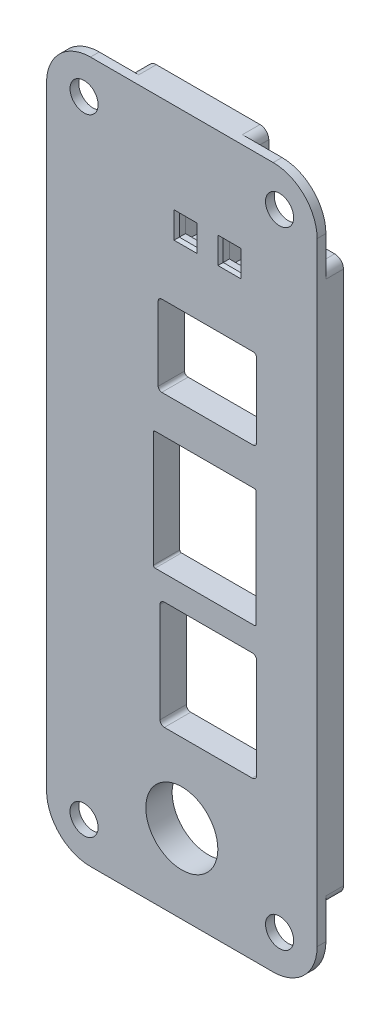
from build123d import *

# Parameters (mm, degrees)
SKETCH_1_W          = 2
SKETCH_1_H          = 2.4
EXTRUDE_1_DEPTH     = 3
SKETCH_2_W          = 11
SKETCH_2_H          = 38
CUT_EXTRUDE_1_DEPTH = 1
CUT_EXTRUDE_START   = -2
CUT_EXTRUDE_2_DEPTH = 2
SKETCH_4_R          = 1.6
CUT_EXTRUDE_3_DEPTH = 62.990079852
SKETCH_6_W          = 2.2
SKETCH_6_H          = 4
CUT_EXTRUDE_4_DEPTH = 2
SKETCH_7_R          = 4.1
CUT_EXTRUDE_5_DEPTH = 63.030395775
FILLET_1_R          = 1
CHAMFER_1_SIZE      = 0.3


with BuildPart() as part:
    # 草图1 → 凸台-拉伸1 (new body)
    with BuildSketch(Plane.XY):
        with BuildLine():
            Line((47.4, -34.9), (47.4, 34.9))
            ThreePointArc((47.4, 34.9), (45.935533906, 38.435533906), (42.4, 39.9))
            Line((42.4, 39.9), (21.6, 39.9))
            ThreePointArc((21.6, 39.9), (18.064466094, 38.435533906), (16.6, 34.9))
            Line((16.6, 34.9), (16.6, -34.9))
            ThreePointArc((16.6, -34.9), (18.064466094, -38.435533906), (21.6, -39.9))
            Line((21.6, -39.9), (42.4, -39.9))
            ThreePointArc((42.4, -39.9), (45.935533906, -38.435533906), (47.4, -34.9))
        make_face()
        with Locations((32.413843028, 28.102429875)):
            Rectangle(SKETCH_1_W, SKETCH_1_H, mode=Mode.SUBTRACT)
        with BuildLine():
            Line((40.513850359, -21.477641558), (40.513850359, -10.127641653))
            ThreePointArc((40.513850359, -10.127641653), (40.367403749, -9.774088262), (40.013850359, -9.627641653))
            Line((40.013850359, -9.627641653), (30.013850359, -9.627641653))
            ThreePointArc((30.013850359, -9.627641653), (29.660296968, -9.774088262), (29.513850359, -10.127641653))
            Line((29.513850359, -10.127641653), (29.513850359, -21.477641558))
            ThreePointArc((29.513850359, -21.477641558), (29.660296968, -21.831194949), (30.013850359, -21.977641558))
            Line((30.013850359, -21.977641558), (40.013850359, -21.977641558))
            ThreePointArc((40.013850359, -21.977641558), (40.367403749, -21.831194949), (40.513850359, -21.477641558))
        make_face(mode=Mode.SUBTRACT)
        with Locations((37.413843028, 28.102429875)):
            Rectangle(SKETCH_1_W, SKETCH_1_H, mode=Mode.SUBTRACT)
        with BuildLine():
            Line((40.464996896, 6.495389649), (40.464996896, -6.604609867))
            ThreePointArc((40.464996896, -6.604609867), (40.406418252, -6.746031223), (40.264996896, -6.804609867))
            Line((40.264996896, -6.804609867), (28.963873947, -6.804609867))
            ThreePointArc((28.963873947, -6.804609867), (28.822452591, -6.746031223), (28.763873947, -6.604609867))
            Line((28.763873947, -6.604609867), (28.763873947, 6.495389649))
            ThreePointArc((28.763873947, 6.495389649), (28.822452591, 6.636811005), (28.963873947, 6.695389649))
            Line((28.963873947, 6.695389649), (40.264996896, 6.695389649))
            ThreePointArc((40.264996896, 6.695389649), (40.406418252, 6.636811005), (40.464996896, 6.495389649))
        make_face(mode=Mode.SUBTRACT)
        with BuildLine():
            Line((40.513843009, 11.302412116), (40.513843009, 19.702429875))
            ThreePointArc((40.513843009, 19.702429875), (40.396685721, 19.985272588), (40.113843009, 20.102429875))
            Line((40.113843009, 20.102429875), (29.713821303, 20.102429875))
            ThreePointArc((29.713821303, 20.102429875), (29.43097859, 19.985272588), (29.313821303, 19.702429875))
            Line((29.313821303, 19.702429875), (29.313821303, 11.302412116))
            ThreePointArc((29.313821303, 11.302412116), (29.43097859, 11.019569403), (29.713821303, 10.902412116))
            Line((29.713821303, 10.902412116), (40.113843009, 10.902412116))
            ThreePointArc((40.113843009, 10.902412116), (40.396685721, 11.019569403), (40.513843009, 11.302412116))
        make_face(mode=Mode.SUBTRACT)
    extrude(amount=-EXTRUDE_1_DEPTH)

    # 草图2 → 切除-拉伸1 (cut)
    with BuildSketch(Plane(origin=(0, 0, -3), x_dir=(-1, 0, 0), z_dir=(0, 0, -1))):
        with Locations((-22.1, 0)):
            Rectangle(SKETCH_2_W, SKETCH_2_H)
    extrude(amount=-CUT_EXTRUDE_1_DEPTH, mode=Mode.SUBTRACT)

    # 草图3 → 切除-拉伸2 (cut)
    with BuildSketch(Plane(origin=(0, 0, -3), x_dir=(-1, 0, 0), z_dir=(0, 0, -1)).offset(CUT_EXTRUDE_START)):
        with BuildLine():
            Line((-47.4, -31.4), (-38.9, -31.4))
            Line((-38.9, -31.4), (-38.9, -39.9))
            Line((-38.9, -39.9), (-42.4, -39.9))
            ThreePointArc((-42.4, -39.9), (-45.935533906, -38.435533906), (-47.4, -34.9))
            Line((-47.4, -34.9), (-47.4, -31.4))
        make_face()
        with BuildLine():
            Line((-47.4, 34.9), (-47.4, 31.4))
            Line((-47.4, 31.4), (-38.9, 31.4))
            Line((-38.9, 31.4), (-38.9, 39.9))
            Line((-38.9, 39.9), (-42.4, 39.9))
            ThreePointArc((-42.4, 39.9), (-45.935533906, 38.435533906), (-47.4, 34.9))
        make_face()
        with BuildLine():
            Line((-16.6, 31.4), (-25.1, 31.4))
            Line((-25.1, 31.4), (-25.1, 39.9))
            Line((-25.1, 39.9), (-21.6, 39.9))
            ThreePointArc((-21.6, 39.9), (-18.064466094, 38.435533906), (-16.6, 34.9))
            Line((-16.6, 34.9), (-16.6, 31.4))
        make_face()
        with BuildLine():
            Line((-16.6, -34.9), (-16.6, -31.4))
            Line((-16.6, -31.4), (-25.1, -31.4))
            Line((-25.1, -31.4), (-25.1, -39.9))
            Line((-25.1, -39.9), (-21.6, -39.9))
            ThreePointArc((-21.6, -39.9), (-18.064466094, -38.435533906), (-16.6, -34.9))
        make_face()
    extrude(amount=CUT_EXTRUDE_2_DEPTH, mode=Mode.SUBTRACT)

    # 草图4 → 切除-拉伸3 (cut, through all)
    with BuildSketch(Plane(origin=(0, 0, -1), x_dir=(-1, 0, 0), z_dir=(0, 0, -1))):
        with Locations((-20.872307757, 35.627692243)):
            Circle(SKETCH_4_R)
        with Locations(Location((-20.872307757, -35.627692243, 0), (0, 0, 180))):
            Circle(SKETCH_4_R)
        with Locations((-43.127692243, -35.627692243)):
            Circle(SKETCH_4_R)
        with Locations(Location((-43.127692243, 35.627692243, 0), (0, 0, 180))):
            Circle(SKETCH_4_R)
    extrude(amount=-CUT_EXTRUDE_3_DEPTH, mode=Mode.SUBTRACT)

    # 草图6 → 切除-拉伸4 (cut)
    with BuildSketch(Plane(origin=(0, 0, -3), x_dir=(-1, 0, 0), z_dir=(0, 0, -1))):
        with Locations((-37.413843028, 28.102429875)):
            Rectangle(SKETCH_6_W, SKETCH_6_H)
        with Locations((-32.413843028, 28.102429875)):
            Rectangle(SKETCH_6_W, SKETCH_6_H)
    extrude(amount=-CUT_EXTRUDE_4_DEPTH, mode=Mode.SUBTRACT)

    # 草图7 → 切除-拉伸5 (cut, through all)
    with BuildSketch(Plane.XY):
        with Locations((32, -30.938820779)):
            Circle(SKETCH_7_R)
    extrude(amount=-CUT_EXTRUDE_5_DEPTH, mode=Mode.SUBTRACT)

    # 圆角1
    fillet_1_edges = [part.edges().sort_by_distance(p)[0] for p in [
        (25.1, -39.9, -2),
        (16.6, -31.4, -2),
        (16.6, 31.4, -2),
        (25.1, 39.9, -2),
        (38.9, 39.9, -2),
        (47.4, 31.4, -2),
        (47.4, -31.4, -2),
        (38.9, -39.9, -2),
    ]]
    fillet(fillet_1_edges, radius=FILLET_1_R)

    # 倒角1
    chamfer_1_edges = [part.edges().sort_by_distance(p)[0] for p in [
        (36.413843028, 28.102429875, 0),
        (37.413843028, 26.902429875, 0),
        (38.413843028, 28.102429875, 0),
        (37.413843028, 29.302429875, 0),
        (32.413843028, 29.302429875, 0),
        (31.413843028, 28.102429875, 0),
        (32.413843028, 26.902429875, 0),
        (33.413843028, 28.102429875, 0),
    ]]
    chamfer(chamfer_1_edges, length=CHAMFER_1_SIZE)


solid = part.part
